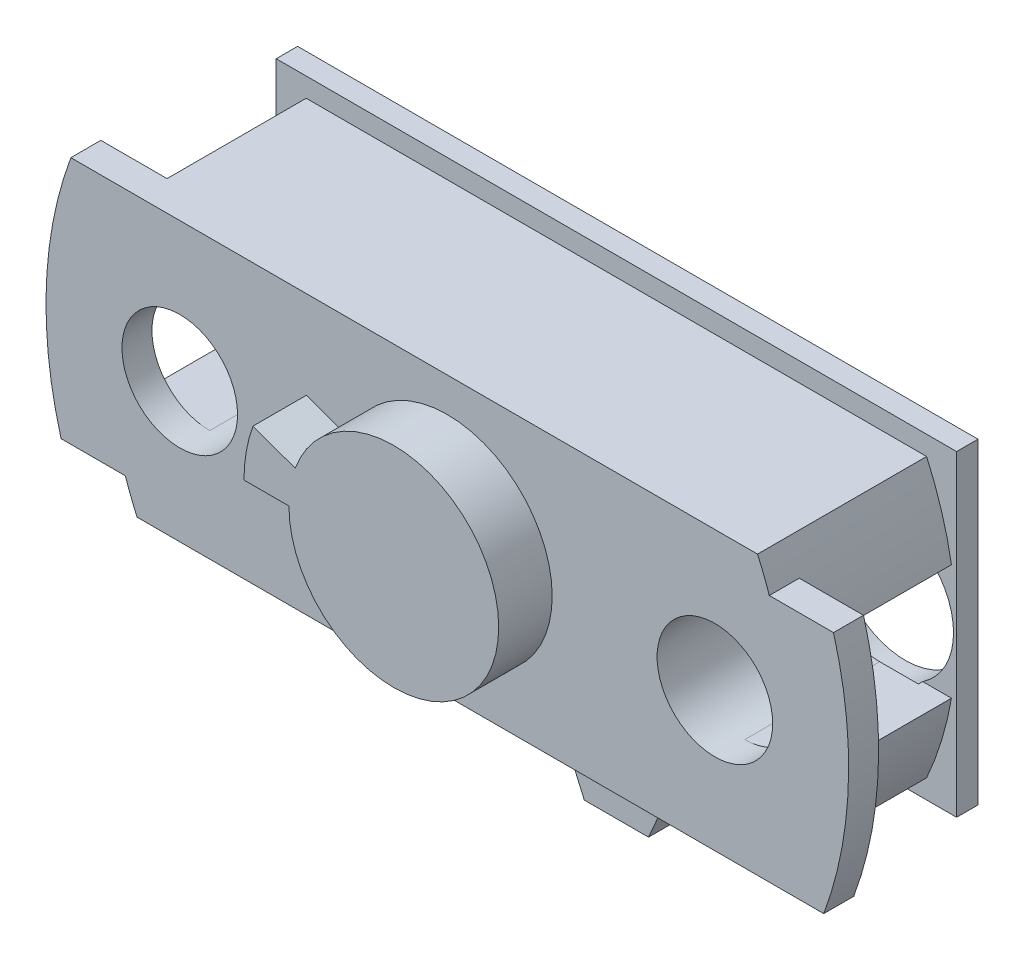
from build123d import *

# Parameters (mm, degrees)
P_IDAT_VYSUNUT_M1_DEPTH  = 1.4
P_IDAT_VYSUNUT_M2_DEPTH  = 2.5
SKICA3_R                 = 2.7
ODEBRAT_VYSUNUT_M1_DEPTH = 2.5
P_IDAT_VYSUNUT_M3_DEPTH  = 7.5
ODEBRAT_START            = -7.5
ODEBRAT_VYSUNUT_M2_DEPTH = 7.5
SKICA9_W                 = 31.786483692
SKICA9_H                 = 14.8
P_IDAT_VYSUNUT_M5_DEPTH  = 1
SKICA6_R                 = 3.25
ODEBRAT_VYSUNUT_M3_DEPTH = 1.2
SKICA7_R                 = 0.95
ODEBRAT_VYSUNUT_M5_DEPTH = 7
P_IDAT_VYSUNUT_M7_DEPTH  = 1


with BuildPart() as part:
    # Skica1 → Přidat vysunutím1 (new body)
    with BuildSketch(Plane.XY):
        with BuildLine():
            ThreePointArc((-17.587282337, 6.5), (-18.735542789, 0.736163289), (-18.043073463, -5.1))
            Line((-18.043073463, -5.1), (-15.043073463, -5.1))
            Line((-15.043073463, -5.1), (-15.043073463, -6.5))
            Line((-15.043073463, -6.5), (17.587282337, -6.5))
            ThreePointArc((17.587282337, -6.5), (18.735542789, -0.736163289), (18.043073463, 5.1))
            Line((18.043073463, 5.1), (15.043073463, 5.1))
            Line((15.043073463, 5.1), (15.043073463, 6.5))
            Line((15.043073463, 6.5), (-17.587282337, 6.5))
        make_face()
    extrude(amount=P_IDAT_VYSUNUT_M1_DEPTH)

    # Skica2 → Přidat vysunutím2 (add)
    with BuildSketch(Plane.XY.offset(1.4)):
        with BuildLine():
            ThreePointArc((-4.9, 0), (4.82555799, -0.850876071), (-4.604493842, 1.675898702))
            Line((-4.604493842, 1.675898702), (-6.577848346, 2.394141003))
            ThreePointArc((-6.577848346, 2.394141003), (-6.893654271, 1.215537244), (-7, 0))
            Line((-7, 0), (-4.9, 0))
        make_face()
    extrude(amount=P_IDAT_VYSUNUT_M2_DEPTH)

    # Skica3 → Odebrat vysunutím1 (cut)
    with BuildSketch(Plane.XY.offset(1.4)):
        with Locations((-12.5, 0)):
            Circle(SKICA3_R)
        with Locations((12.5, 0)):
            Circle(SKICA3_R)
    extrude(amount=-ODEBRAT_VYSUNUT_M1_DEPTH, mode=Mode.SUBTRACT)

    # Skica4 → Přidat vysunutím3 (add)
    with BuildSketch(Plane(origin=(0, 0, 0), x_dir=(-1, 0, 0), z_dir=(0, 0, -1))):
        with BuildLine():
            Line((14.493241846, 6.5), (-14.493241846, 6.5))
            ThreePointArc((-14.493241846, 6.5), (-15.192361337, 4.636401214), (-15.652924941, 2.7))
            Line((-15.652924941, 2.7), (-12.5, 2.7))
            ThreePointArc((-12.5, 2.7), (-10.590811691, 1.909188309), (-9.8, 0))
            ThreePointArc((-9.8, 0), (-10.590811691, -1.909188309), (-12.5, -2.7))
            Line((-12.5, -2.7), (-15.652924941, -2.7))
            ThreePointArc((-15.652924941, -2.7), (-15.192361337, -4.636401214), (-14.493241846, -6.5))
            Line((-14.493241846, -6.5), (14.493241846, -6.5))
            ThreePointArc((14.493241846, -6.5), (15.192361337, -4.636401214), (15.652924941, -2.7))
            Line((15.652924941, -2.7), (12.5, -2.7))
            ThreePointArc((12.5, -2.7), (9.8, 0), (12.5, 2.7))
            Line((12.5, 2.7), (15.652924941, 2.7))
            ThreePointArc((15.652924941, 2.7), (15.192361337, 4.636401214), (14.493241846, 6.5))
        make_face()
    extrude(amount=P_IDAT_VYSUNUT_M3_DEPTH)

    # Skica5 → Odebrat vysunutím2 (cut)
    with BuildSketch(Plane(origin=(0, 0, 0), x_dir=(-1, 0, 0), z_dir=(0, 0, -1)).offset(ODEBRAT_START)):
        with BuildLine():
            Line((15.043073463, -6.5), (15.043073463, -5.1))
            ThreePointArc((15.043073463, -5.1), (14.784738094, -5.80651175), (14.493241846, -6.5))
            Line((14.493241846, -6.5), (15.043073463, -6.5))
        make_face()
        with BuildLine():
            ThreePointArc((-15.043073463, 5.1), (-14.784738094, 5.80651175), (-14.493241846, 6.5))
            Line((-14.493241846, 6.5), (-15.043073463, 6.5))
            Line((-15.043073463, 6.5), (-15.043073463, 5.1))
        make_face()
    extrude(amount=ODEBRAT_VYSUNUT_M2_DEPTH, mode=Mode.SUBTRACT)

    # Skica9 → Přidat vysunutím5 (add)
    with BuildSketch(Plane(origin=(0, 0, -7.5), x_dir=(-1, 0, 0), z_dir=(0, 0, -1))):
        Rectangle(SKICA9_W, SKICA9_H)
    extrude(amount=-P_IDAT_VYSUNUT_M5_DEPTH)

    # Skica6 → Odebrat vysunutím3 (cut)
    with BuildSketch(Plane(origin=(0, 0, -7.5), x_dir=(-1, 0, 0), z_dir=(0, 0, -1))):
        with Locations((-12.5, 0)):
            Circle(SKICA6_R)
        with Locations((12.5, 0)):
            Circle(SKICA6_R)
    extrude(amount=-ODEBRAT_VYSUNUT_M3_DEPTH, mode=Mode.SUBTRACT)

    # Skica7 → Odebrat vysunutím5 (cut)
    with BuildSketch(Plane(origin=(0, 0, -7.5), x_dir=(-1, 0, 0), z_dir=(0, 0, -1))):
        with Locations((10.083296, 4.829031143)):
            Circle(SKICA7_R)
        with Locations((-10.083296, -4.829031143)):
            Circle(SKICA7_R)
    extrude(amount=-ODEBRAT_VYSUNUT_M5_DEPTH, mode=Mode.SUBTRACT)

    # Skica12 → Přidat vysunutím7 (add)
    with BuildSketch(Plane(origin=(0, 0, -7.5), x_dir=(-1, 0, 0), z_dir=(0, 0, -1))):
        Polygon((-5, -7.4), (-1.5, -15.4), (1.5, -15.4), (5, -7.4), align=None)
    extrude(amount=-P_IDAT_VYSUNUT_M7_DEPTH)


solid = part.part
